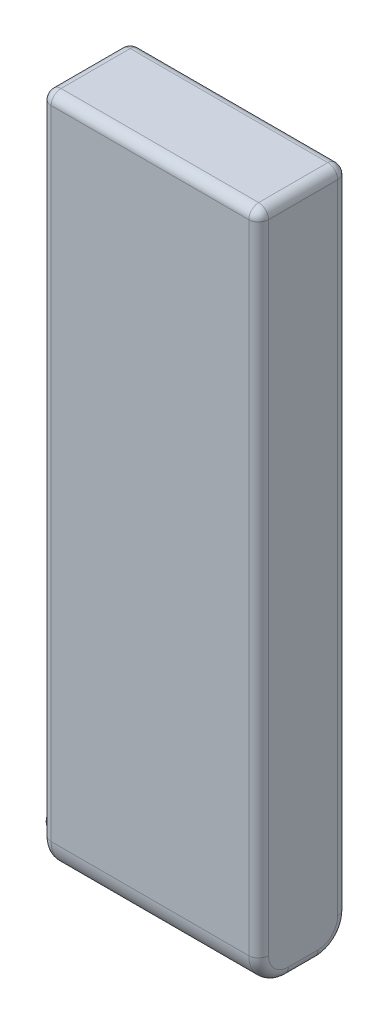
from build123d import *

# Parameters (mm, degrees)
SKETCH1_W           = 137
SKETCH1_H           = 44
BOSS_EXTRUDE1_DEPTH = 18
FILLET1_R           = 6
FILLET2_R           = 2
SKETCH2_R           = 2.5
BOSS_EXTRUDE2_DEPTH = 2


with BuildPart() as part:
    # Sketch1 → Boss-Extrude1 (new body)
    with BuildSketch(Plane(origin=(0, 0, 0), x_dir=(0, 1, 0), z_dir=(0, 0, 1))):
        Rectangle(SKETCH1_W, SKETCH1_H)
    extrude(amount=BOSS_EXTRUDE1_DEPTH)

    # Fillet1
    fillet1_edges = [part.edges().sort_by_distance(p)[0] for p in [
        (0, -68.5, 18),
        (0, -68.5, 0),
    ]]
    fillet(fillet1_edges, radius=FILLET1_R)

    # Fillet2
    fillet2_edges = [part.edges().sort_by_distance(p)[0] for p in [
        (22, -68.5, 9),
        (-22, -68.5, 9),
        (22, 3, 0),
        (22, 3, 18),
        (22, -66.742640687, 16.242640687),
        (22, -66.742640687, 1.757359313),
        (-22, -66.742640687, 16.242640687),
        (-22, -66.742640687, 1.757359313),
        (0, 68.5, 18),
        (-22, 3, 0),
        (0, 68.5, 0),
        (22, 68.5, 9),
        (-22, 68.5, 9),
        (-22, 3, 18),
    ]]
    fillet(fillet2_edges, radius=FILLET2_R)

    # Sketch2 → Boss-Extrude2 (add)
    with BuildSketch(Plane(origin=(-22, 0, 0), x_dir=(0, -1, 0), z_dir=(-1, 0, 0))):
        with Locations(Location((62.5, 12.5, 0), (0, 0, 270))):
            Circle(SKETCH2_R)
        with Locations(Location((62.5, 5.5, 0), (0, 0, 270))):
            Circle(SKETCH2_R)
    extrude(amount=BOSS_EXTRUDE2_DEPTH)


solid = part.part
